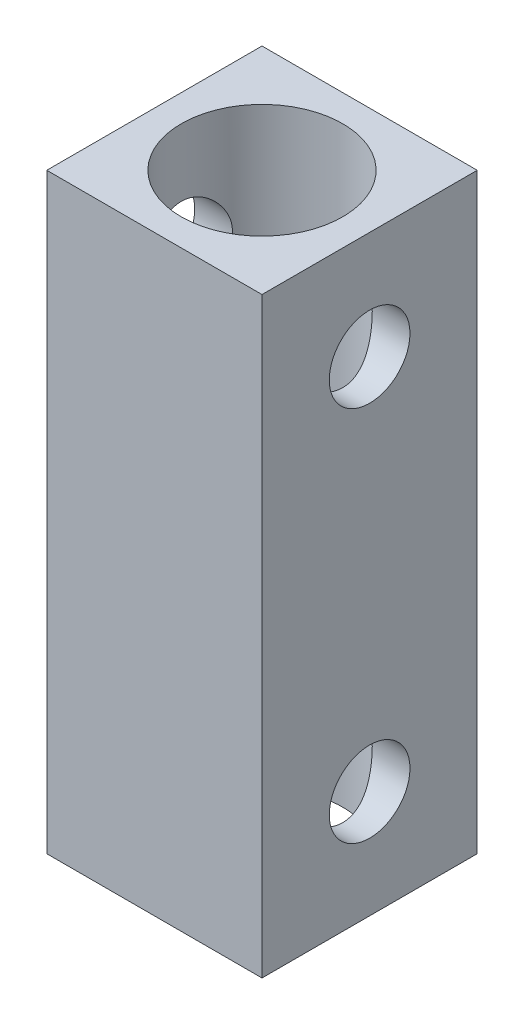
from build123d import *

# Parameters (mm, degrees)
SKETCH1_W           = 8
SKETCH1_H           = 8
SKETCH1_R           = 3
BOSS_EXTRUDE2_DEPTH = 22
CUT_EXTRUDE1_REACH  = 25.749
SKETCH2_R           = 1.5


with BuildPart() as part:
    # Sketch1 → Boss-Extrude2 (new body)
    with BuildSketch(Plane(origin=(0, 0, 0), x_dir=(1, 0, 0), z_dir=(0, 1, 0))):
        Rectangle(SKETCH1_W, SKETCH1_H)
        with Locations(Location((0, 0, 0), (0, 0, 270))):
            Circle(SKETCH1_R, mode=Mode.SUBTRACT)
    extrude(amount=BOSS_EXTRUDE2_DEPTH)

    # Cut-Extrude1: up to this face of the body (flat: up to its plane)
    cut_extrude1_end = Plane(part.part.faces().sort_by_distance((-4, 11, 0))[0])
    # Sketch2 → Cut-Extrude1 (cut, up to the picked face)
    with BuildSketch(Plane(origin=(4, 0, 0), x_dir=(0, 0, -1), z_dir=(1, 0, 0)), mode=Mode.PRIVATE) as cut_extrude1_sk1:
        with Locations((0, 18)):
            Circle(SKETCH2_R)
    cut_extrude1_tool1 = split(extrude(cut_extrude1_sk1.sketch, amount=-CUT_EXTRUDE1_REACH, mode=Mode.PRIVATE), bisect_by=cut_extrude1_end, keep=Keep.BOTH, mode=Mode.PRIVATE)
    # Sketch2 → Cut-Extrude1 (cut, up to the picked face)
    with BuildSketch(Plane(origin=(4, 0, 0), x_dir=(0, 0, -1), z_dir=(1, 0, 0)), mode=Mode.PRIVATE) as cut_extrude1_sk2:
        with Locations((0, 4)):
            Circle(SKETCH2_R)
    cut_extrude1_tool2 = split(extrude(cut_extrude1_sk2.sketch, amount=-CUT_EXTRUDE1_REACH, mode=Mode.PRIVATE), bisect_by=cut_extrude1_end, keep=Keep.BOTH, mode=Mode.PRIVATE)
    add(cut_extrude1_tool1.solids().sort_by(Axis((4, 18, 0), (-1, 0, 0)))[0], mode=Mode.SUBTRACT)
    add(cut_extrude1_tool2.solids().sort_by(Axis((4, 4, 0), (-1, 0, 0)))[0], mode=Mode.SUBTRACT)


solid = part.part
